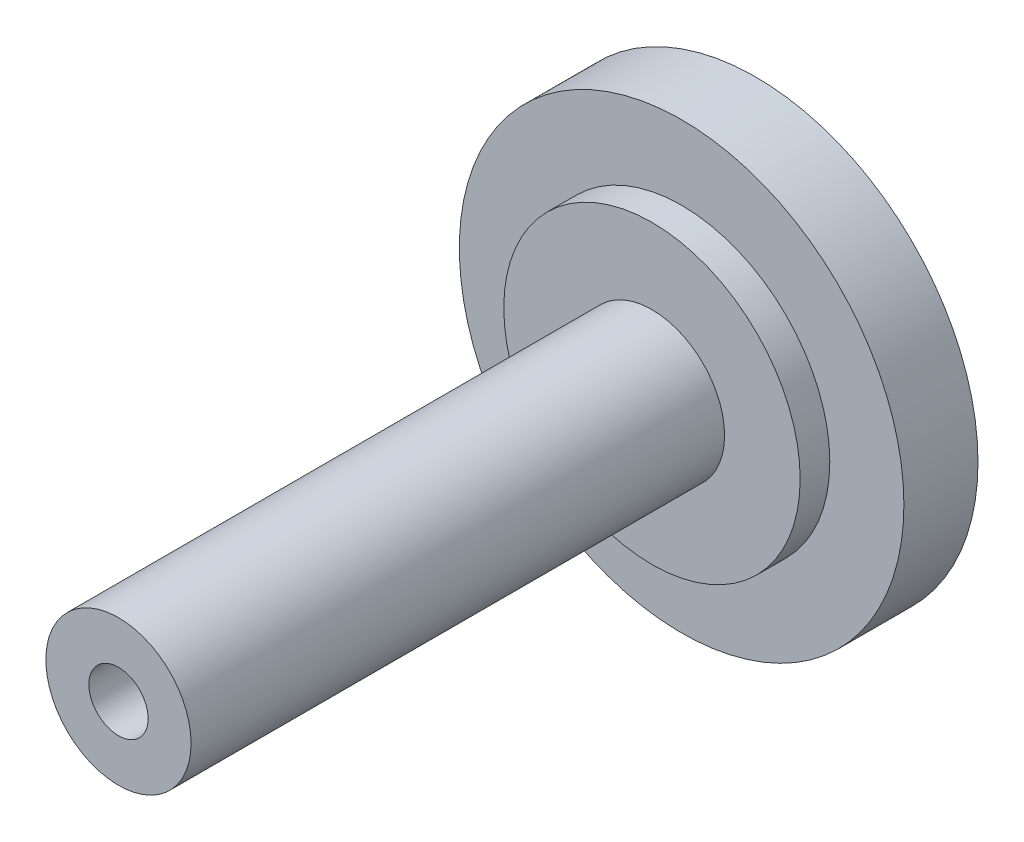
from build123d import *

# Parameters (mm, degrees)
SKETCH_1_R               = 7.5
EXTRUDE_1_DEPTH          = 2.5
SKETCH_2_R               = 5
EXTRUDE_2_DEPTH          = 1
SKETCH_3_R               = 2.45
EXTRUDE_3_DEPTH          = 18
SKETCH_4_R               = 1
CUT_EXTRUDE_1_DEPTH      = 10
CUT_EXTRUDE_2_DEPTH      = 3.1
CUT_EXTRUDE_2_DEPTH_BACK = 3.1
SKETCH_5_R               = 3


with BuildPart() as part:
    # 스케치1 → 보스-돌출1 (new body)
    with BuildSketch(Plane.XY):
        Circle(SKETCH_1_R)
    extrude(amount=EXTRUDE_1_DEPTH)

    # 스케치2 → 보스-돌출2 (add)
    with BuildSketch(Plane.XY.offset(2.5)):
        Circle(SKETCH_2_R)
    extrude(amount=EXTRUDE_2_DEPTH)

    # 스케치3 → 보스-돌출3 (add)
    with BuildSketch(Plane.XY.offset(3.5)):
        Circle(SKETCH_3_R)
    extrude(amount=EXTRUDE_3_DEPTH)

    # 스케치4 → 컷-돌출1 (cut)
    with BuildSketch(Plane.XY.offset(21.5)):
        Circle(SKETCH_4_R)
    extrude(amount=-CUT_EXTRUDE_1_DEPTH, mode=Mode.SUBTRACT)

    # 스케치5 → 컷-돌출2 (cut, two sides: drawn at the far end of the back side and taken through both)
    with BuildSketch(Plane(origin=(0, 0, 0), x_dir=(1, 0, 0), z_dir=(0, 1, 0)).offset(-CUT_EXTRUDE_2_DEPTH_BACK)):
        Circle(SKETCH_5_R)
    extrude(amount=CUT_EXTRUDE_2_DEPTH + CUT_EXTRUDE_2_DEPTH_BACK, mode=Mode.SUBTRACT)


solid = part.part
